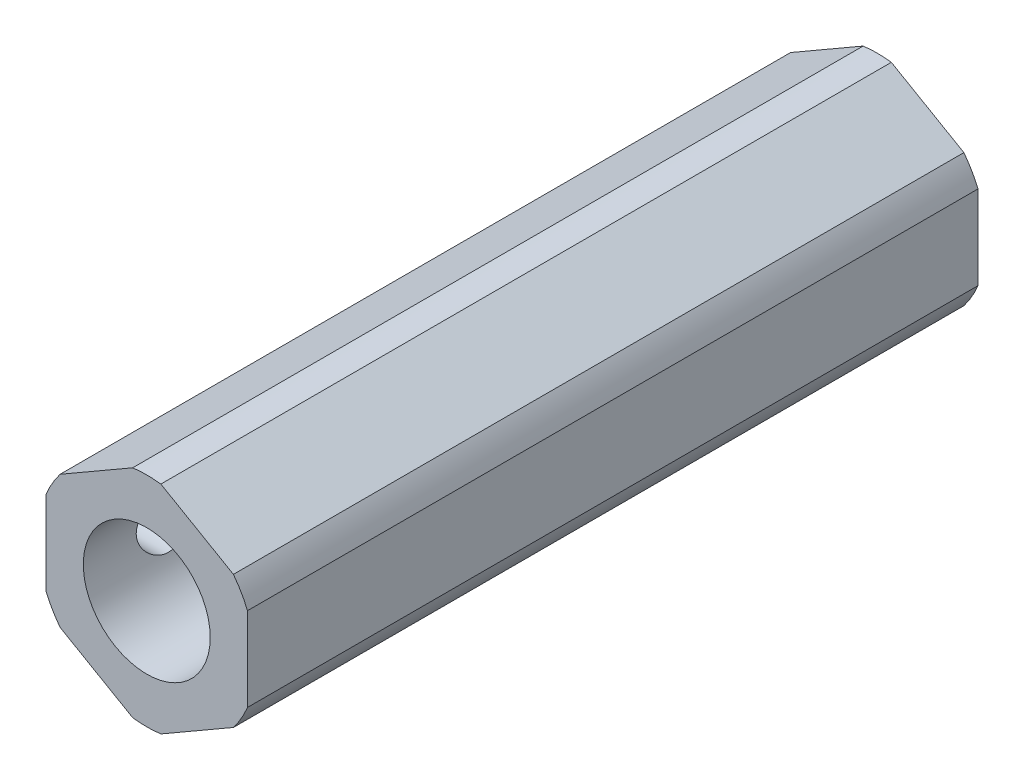
from build123d import *

# Parameters (mm, degrees)
BASIC_ROD_DEPTH         = 23.01875
BASIC_ROD_DEPTH_BACK    = 23.01875
SKETCH1_R               = 6.35
THEX_DEPTH              = 23.01875
INTERNAL_CUT_DEPTH      = 25.849128119
INTERNAL_CUT_DEPTH_BACK = 25.849128119
SKETCH2_R               = 2.11582
SKETCH9_R               = 4
CUT_EXTRUDE1_DEPTH      = 19.99996
CUT_EXTRUDE2_REACH      = 29.174
CUT_EXTRUDE2_END_RADIUS = 4
SKETCH10_R              = 1.66624


with BuildPart() as part:
    # Sketch1 → Basic Rod (new, two sides: drawn at the far end of the back side and taken through both)
    with BuildSketch(Plane.XY.offset(-BASIC_ROD_DEPTH_BACK)):
        Circle(SKETCH1_R)
    extrude(amount=BASIC_ROD_DEPTH + BASIC_ROD_DEPTH_BACK)

    # Sketch8 → THex (add, symmetric)
    with BuildSketch(Plane.XY):
        with BuildLine():
            Line((-0.888411378, 6.819423871), (-5.461588622, 4.179098758))
            ThreePointArc((-5.461588622, 4.179098758), (-5.955700003, 3.438525), (-6.35, 2.640325113))
            Line((-6.35, 2.640325113), (-6.35, -2.640325113))
            ThreePointArc((-6.35, -2.640325113), (-5.955700003, -3.438525), (-5.461588622, -4.179098758))
            Line((-5.461588622, -4.179098758), (-0.888411378, -6.819423871))
            ThreePointArc((-0.888411378, -6.819423871), (0, -6.87705), (0.888411378, -6.819423871))
            Line((0.888411378, -6.819423871), (5.461588622, -4.179098758))
            ThreePointArc((5.461588622, -4.179098758), (5.955700003, -3.438525), (6.35, -2.640325113))
            Line((6.35, -2.640325113), (6.35, 2.640325113))
            ThreePointArc((6.35, 2.640325113), (5.955700003, 3.438525), (5.461588622, 4.179098758))
            Line((5.461588622, 4.179098758), (0.888411378, 6.819423871))
            ThreePointArc((0.888411378, 6.819423871), (0, 6.87705), (-0.888411378, 6.819423871))
        make_face()
    extrude(amount=THEX_DEPTH, both=True)

    # Sketch2 → Internal Cut (cut, two sides: drawn at the far end of the back side and taken through both)
    with BuildSketch(Plane.XY.offset(-INTERNAL_CUT_DEPTH_BACK)):
        Circle(SKETCH2_R)
    extrude(amount=INTERNAL_CUT_DEPTH + INTERNAL_CUT_DEPTH_BACK, mode=Mode.SUBTRACT)

    # Sketch9 → Cut-Extrude1 (cut)
    with BuildSketch(Plane.XY.offset(23.01875)):
        Circle(SKETCH9_R)
    extrude(amount=-CUT_EXTRUDE1_DEPTH, mode=Mode.SUBTRACT)

    # Cut-Extrude2: up to this cylinder (the profile starts outside it)
    cut_extrude2_end = Plane(origin=(0, 0, 14.01699), z_dir=(0, 0, 1)) * Cylinder(CUT_EXTRUDE2_END_RADIUS, 75.349, mode=Mode.PRIVATE)
    # Sketch10 → Cut-Extrude2 (cut, up to the surface)
    with BuildSketch(Plane.ZY.offset(6.35), mode=Mode.PRIVATE) as cut_extrude2_sk1:
        with Locations((10.01649, 0)):
            Circle(SKETCH10_R)
    cut_extrude2_tool1 = extrude(cut_extrude2_sk1.sketch, amount=-CUT_EXTRUDE2_REACH, mode=Mode.PRIVATE) - cut_extrude2_end
    add(cut_extrude2_tool1.solids().sort_by_distance((-6.35, 0, 10.01649))[0], mode=Mode.SUBTRACT)
    # Sketch10 → Cut-Extrude2 (cut, up to the surface)
    with BuildSketch(Plane.ZY.offset(6.35), mode=Mode.PRIVATE) as cut_extrude2_sk2:
        with Locations((18.01749, 0)):
            Circle(SKETCH10_R)
    cut_extrude2_tool2 = extrude(cut_extrude2_sk2.sketch, amount=-CUT_EXTRUDE2_REACH, mode=Mode.PRIVATE) - cut_extrude2_end
    add(cut_extrude2_tool2.solids().sort_by_distance((-6.35, 0, 18.01749))[0], mode=Mode.SUBTRACT)


solid = part.part
